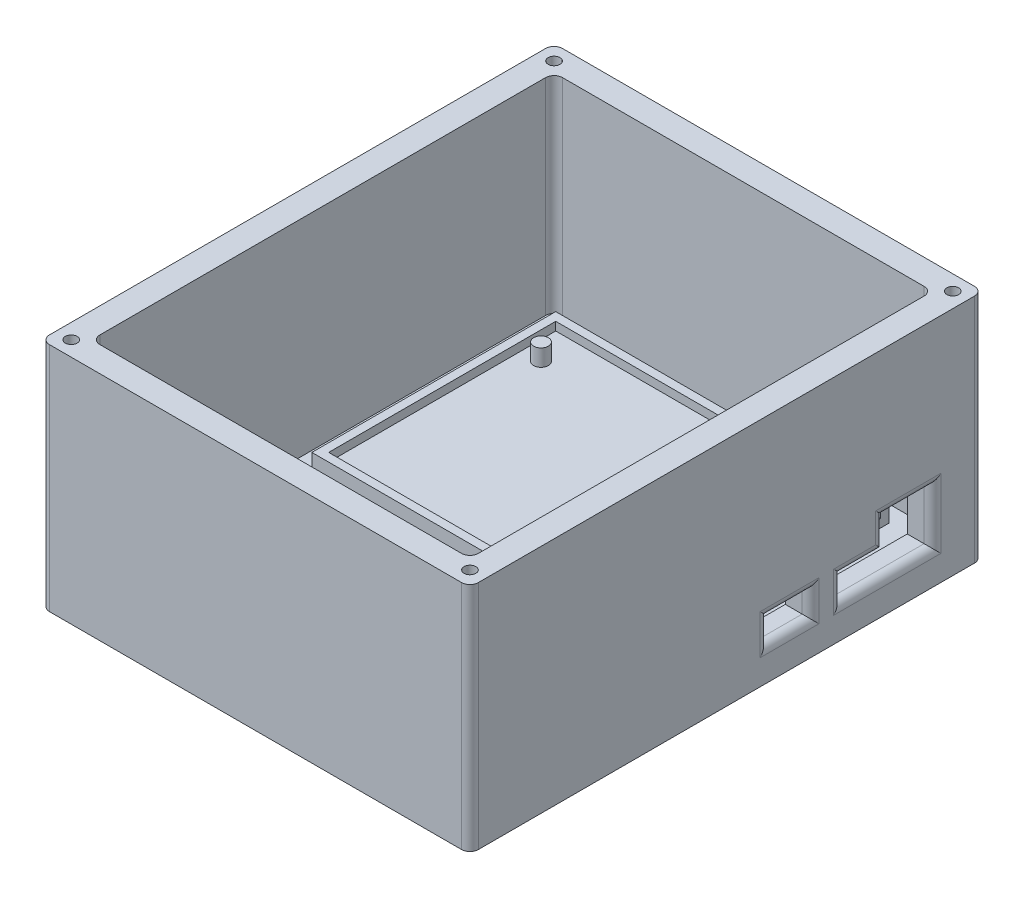
from build123d import *

# Parameters (mm, degrees)
SKETCH1_W               = 90
SKETCH1_H               = 110
BOSS_EXTRUDE2_DEPTH     = 6
SKETCH4_W               = 102
SKETCH4_H               = 122
SKETCH4_W_2             = 90
SKETCH4_H_2             = 110
BOSS_EXTRUDE3_DEPTH     = 55
SKETCH6_W               = 81.2
SKETCH6_H               = 58
SKETCH6_W_2             = 77.2
SKETCH6_H_2             = 54
BOSS_EXTRUDE4_DEPTH     = 4
CUT_EXTRUDE1_DEPTH      = 4
SKETCH12_W              = 77.2
SKETCH12_H              = 54
BOSS_EXTRUDE5_DEPTH     = 2
CUT_EXTRUDE2_REACH      = 165.966
FILLET1_R               = 2
FILLET2_R               = 2
FILLET3_R               = 2
BOSS_EXTRUDE7_DEPTH     = 4
SKETCH14_R              = 1.4
CUT_EXTRUDE3_DEPTH      = 8
MIRROR2_COPY_1_SKETCH_R = 1.4
MIRROR2_COPY_1_DEPTH    = 8


with BuildPart() as part:
    # Sketch1 → Boss-Extrude2 (new body)
    with BuildSketch(Plane(origin=(0, 0, 0), x_dir=(1, 0, 0), z_dir=(0, 1, 0))):
        with Locations((-45, 55)):
            Rectangle(SKETCH1_W, SKETCH1_H)
    extrude(amount=BOSS_EXTRUDE2_DEPTH)

    # Sketch4 → Boss-Extrude3 (add)
    with BuildSketch(Plane.XZ):
        with Locations((-45, -55)):
            Rectangle(SKETCH4_W, SKETCH4_H)
        with Locations((-45, -55)):
            Rectangle(SKETCH4_W_2, SKETCH4_H_2, mode=Mode.SUBTRACT)
    extrude(amount=-BOSS_EXTRUDE3_DEPTH)

    # Sketch6 → Boss-Extrude4 (add)
    with BuildSketch(Plane(origin=(0, 6, 0), x_dir=(1, 0, 0), z_dir=(0, 1, 0))):
        with Locations((-45, 77)):
            Rectangle(SKETCH6_W, SKETCH6_H)
        with Locations((-45, 77)):
            Rectangle(SKETCH6_W_2, SKETCH6_H_2, mode=Mode.SUBTRACT)
    extrude(amount=BOSS_EXTRUDE4_DEPTH)

    # Sketch11 → Cut-Extrude1 (cut)
    with BuildSketch(Plane(origin=(0, 10, 0), x_dir=(1, 0, 0), z_dir=(0, 1, 0))):
        Polygon((-6.4, 106), (-6.4, 104), (-6.4, 50), (-6.4, 48), (-4.4, 48), (-4.4, 106), align=None)
    extrude(amount=-CUT_EXTRUDE1_DEPTH, mode=Mode.SUBTRACT)

    # Sketch12 → Boss-Extrude5 (add)
    with BuildSketch(Plane(origin=(0, 6, 0), x_dir=(1, 0, 0), z_dir=(0, 1, 0))):
        with Locations((-45, 77)):
            Rectangle(SKETCH12_W, SKETCH12_H)
    extrude(amount=BOSS_EXTRUDE5_DEPTH)

    # Sketch10 → Cut-Extrude2 (cut, up to next)
    with BuildSketch(Plane(origin=(6, 0, 0), x_dir=(0, 0, -1), z_dir=(1, 0, 0)), mode=Mode.PRIVATE) as cut_extrude2_sk1:
        Polygon((92.5, 8), (104, 8), (104, 20.5), (92.5, 20.5), (92.5, 13.5), align=None)
    cut_extrude2_tool1 = extrude(cut_extrude2_sk1.sketch, amount=-CUT_EXTRUDE2_REACH, mode=Mode.PRIVATE) & part.part
    # Sketch10 → Cut-Extrude2 (cut, up to next)
    with BuildSketch(Plane(origin=(6, 0, 0), x_dir=(0, 0, -1), z_dir=(1, 0, 0)), mode=Mode.PRIVATE) as cut_extrude2_sk2:
        Polygon((82.5, 8), (92.5, 8), (92.5, 13.5), (82.5, 13.5), (82.5, 11.241721358), align=None)
    cut_extrude2_tool2 = extrude(cut_extrude2_sk2.sketch, amount=-CUT_EXTRUDE2_REACH, mode=Mode.PRIVATE) & part.part
    # Sketch10 → Cut-Extrude2 (cut, up to next)
    with BuildSketch(Plane(origin=(6, 0, 0), x_dir=(0, 0, -1), z_dir=(1, 0, 0)), mode=Mode.PRIVATE) as cut_extrude2_sk3:
        Polygon((65, 13.5), (65, 8), (75, 8), (75, 11.241721358), (75, 13.5), align=None)
    cut_extrude2_tool3 = extrude(cut_extrude2_sk3.sketch, amount=-CUT_EXTRUDE2_REACH, mode=Mode.PRIVATE) & part.part
    add(cut_extrude2_tool1.solids().sort_by_distance((6, 14.25, -98.25))[0], mode=Mode.SUBTRACT)
    add(cut_extrude2_tool2.solids().sort_by_distance((6, 10.75, -87.5))[0], mode=Mode.SUBTRACT)
    add(cut_extrude2_tool3.solids().sort_by_distance((6, 10.75, -70))[0], mode=Mode.SUBTRACT)

    # Fillet1
    fillet1_edges = [part.edges().sort_by_distance(p)[0] for p in [
        (6, 17, -92.5),
        (6, 13.5, -87.5),
        (6, 10.75, -82.5),
        (6, 8, -93.25),
        (6, 14.25, -104),
        (6, 20.5, -98.25),
        (6, 10.75, -65),
        (6, 8, -70),
        (6, 10.75, -75),
        (6, 13.5, -70),
    ]]
    fillet(fillet1_edges, radius=FILLET1_R)

    # Fillet2
    fillet2_edges = [part.edges().sort_by_distance(p)[0] for p in [
        (-96, 27.5, -116),
        (-96, 27.5, 6),
        (6, 27.5, 6),
        (6, 27.5, -116),
    ]]
    fillet(fillet2_edges, radius=FILLET2_R)

    # Fillet3
    fillet3_edges = [part.edges().sort_by_distance(p)[0] for p in [
        (0, 30.5, 0),
        (0, 30.5, -110),
        (-90, 30.5, -110),
        (-90, 30.5, 0),
    ]]
    fillet(fillet3_edges, radius=FILLET3_R)

    # Sketch13 → Boss-Extrude7 (add)
    with BuildSketch(Plane(origin=(0, 8, 0), x_dir=(1, 0, 0), z_dir=(0, 1, 0))):
        with BuildLine():
            ThreePointArc((-77.35, 96), (-77.862563133, 97.237436867), (-79.1, 97.75))
            Line((-79.1, 97.75), (-79.1, 96))
            Line((-79.1, 96), (-80.85, 96))
            ThreePointArc((-80.85, 96), (-79.1, 94.25), (-77.35, 96))
        make_face()
        with BuildLine():
            Line((-79.1, 96), (-79.1, 97.75))
            ThreePointArc((-79.1, 97.75), (-80.337436867, 97.237436867), (-80.85, 96))
            Line((-80.85, 96), (-79.1, 96))
        make_face()
        with BuildLine():
            ThreePointArc((-18.6, 52.25), (-17.362563133, 52.762563133), (-16.85, 54))
            Line((-16.85, 54), (-18.6, 54))
            Line((-18.6, 54), (-18.6, 52.25))
        make_face()
        with BuildLine():
            Line((-18.6, 54), (-16.85, 54))
            ThreePointArc((-16.85, 54), (-19.837436867, 55.237436867), (-18.6, 52.25))
            Line((-18.6, 52.25), (-18.6, 54))
        make_face()
    extrude(amount=BOSS_EXTRUDE7_DEPTH)

    # Sketch14 → Cut-Extrude3 (cut)
    with BuildSketch(Plane(origin=(0, 55, 0), x_dir=(1, 0, 0), z_dir=(0, 1, 0))):
        with Locations(Location((-92.414213562, 112.414213562, 0), (0, 0, 270))):
            Circle(SKETCH14_R)
    cut_extrude3 = extrude(amount=-CUT_EXTRUDE3_DEPTH, mode=Mode.SUBTRACT)

    # Mirror1: Cut-Extrude3 across plane
    add(cut_extrude3.mirror(Plane.ZY.offset(45)), mode=Mode.SUBTRACT)

    # Mirror2: Cut-Extrude3 across plane
    add(cut_extrude3.mirror(Plane(origin=(0, 0, -55), x_dir=(1, 0, 0), z_dir=(0, 0, -1))), mode=Mode.SUBTRACT)

    # Mirror2 copy 1 sketch → Mirror2 copy 1 (cut)
    with BuildSketch(Plane(origin=(-90, 55, -110), x_dir=(-1, 0, 0), z_dir=(0, 1, 0))):
        with Locations(Location((-92.414213562, 112.414213562, 0), (0, 0, 270))):
            Circle(MIRROR2_COPY_1_SKETCH_R)
    extrude(amount=-MIRROR2_COPY_1_DEPTH, mode=Mode.SUBTRACT)


solid = part.part
